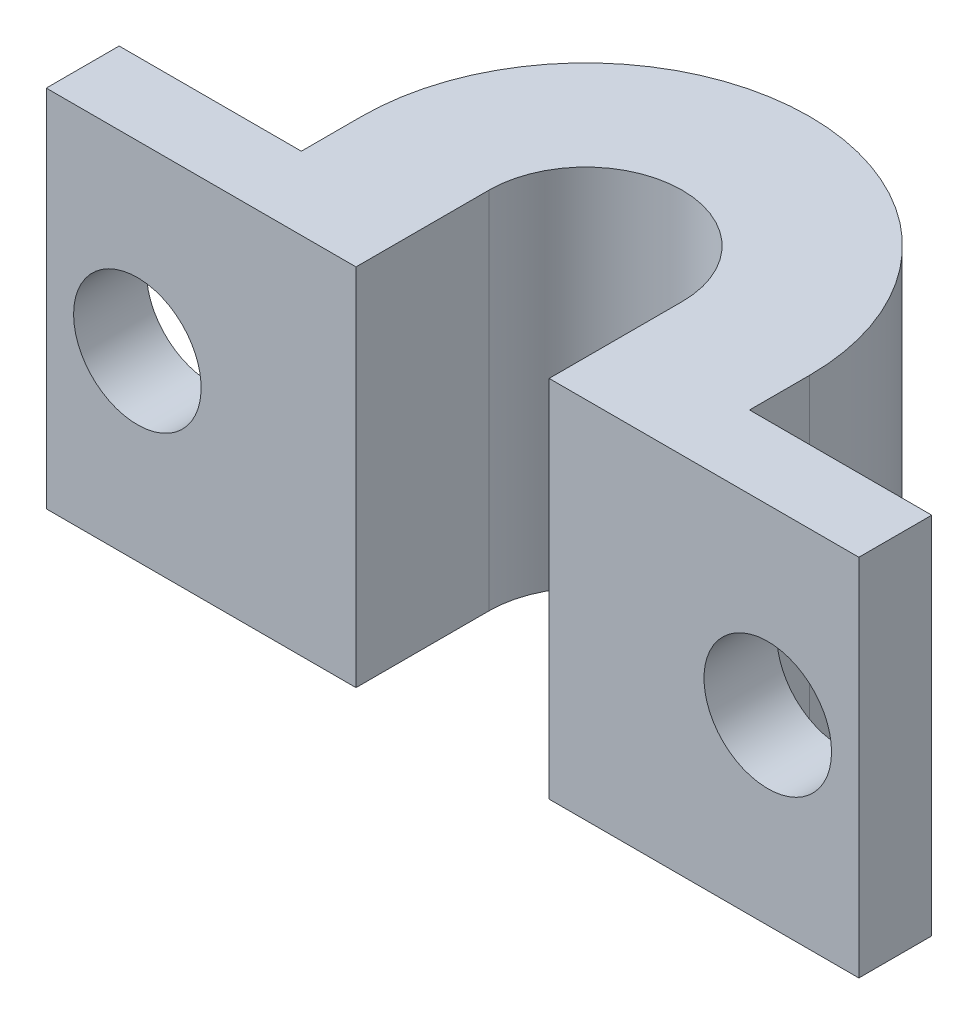
from build123d import *

# Parameters (mm, degrees)
EXTRUDE_1_DEPTH     = 10
SKETCH_2_R          = 1.75
CUT_EXTRUDE_1_DEPTH = 10


with BuildPart() as part:
    # 草图1 → 凸台-拉伸1 (new body)
    with BuildSketch(Plane(origin=(0, 0, 0), x_dir=(1, 0, 0), z_dir=(0, 1, 0))):
        with BuildLine():
            Line((6.15, 0), (6.15, -1.65))
            Line((6.15, -1.65), (11.15, -1.65))
            Line((11.15, -1.65), (11.15, -3.65))
            Line((11.15, -3.65), (6.15, -3.65))
            Line((6.15, -3.65), (2.65, -3.65))
            Line((2.65, -3.65), (2.65, -2.65))
            Line((2.65, -2.65), (2.65, 0))
            ThreePointArc((2.65, 0), (0, 2.65), (-2.65, 0))
            Line((-2.65, 0), (-2.65, -2.65))
            Line((-2.65, -2.65), (-2.65, -3.65))
            Line((-2.65, -3.65), (-6.15, -3.65))
            Line((-6.15, -3.65), (-11.15, -3.65))
            Line((-11.15, -3.65), (-11.15, -1.65))
            Line((-11.15, -1.65), (-6.15, -1.65))
            Line((-6.15, -1.65), (-6.15, 0))
            ThreePointArc((-6.15, 0), (0, 6.15), (6.15, 0))
        make_face()
    extrude(amount=EXTRUDE_1_DEPTH)

    # 草图2 → 切除-拉伸1 (cut)
    with BuildSketch(Plane(origin=(0, 0, 1.65), x_dir=(-1, 0, 0), z_dir=(0, 0, -1))):
        with Locations((8.65, 5)):
            Circle(SKETCH_2_R)
        with Locations(Location((-8.65, 5, 0), (0, 0, 180))):
            Circle(SKETCH_2_R)
    extrude(amount=-CUT_EXTRUDE_1_DEPTH, mode=Mode.SUBTRACT)


solid = part.part
